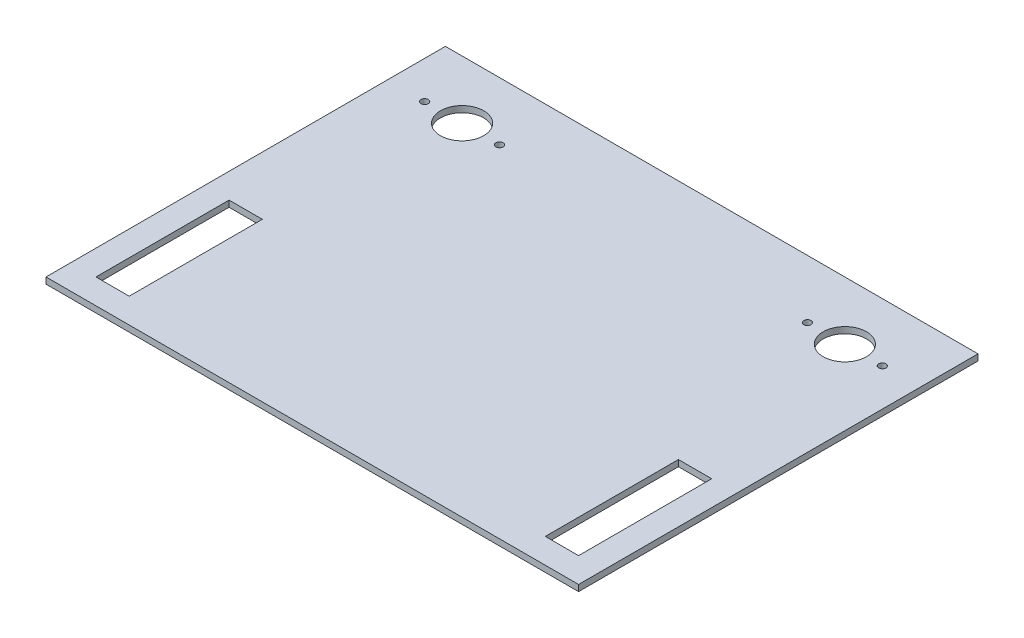
from build123d import *

# Parameters (mm, degrees)
SKETCH1_W           = 406.4
SKETCH1_H           = 304.8
BOSS_EXTRUDE1_DEPTH = 4.7625
SKETCH2_R           = 16.51
SKETCH2_R_2         = 2.778125
SKETCH2_W           = 25.4
SKETCH2_H           = 101.6
CUT_EXTRUDE1_DEPTH  = 6.35


with BuildPart() as part:
    # Sketch1 → Boss-Extrude1 (new body)
    with BuildSketch(Plane(origin=(0, 0, 0), x_dir=(1, 0, 0), z_dir=(0, 1, 0))):
        with Locations((203.2, 152.4)):
            Rectangle(SKETCH1_W, SKETCH1_H)
    extrude(amount=BOSS_EXTRUDE1_DEPTH)

    # Sketch2 → Cut-Extrude1 (cut)
    with BuildSketch(Plane(origin=(0, 4.7625, 0), x_dir=(1, 0, 0), z_dir=(0, 1, 0))):
        with Locations(Location((57.15, 260.35, 0), (0, 0, 270))):
            Circle(SKETCH2_R)
        with Locations(Location((85.725, 260.35, 0), (0, 0, 270))):
            Circle(SKETCH2_R_2)
        with Locations(Location((28.575, 260.35, 0), (0, 0, 270))):
            Circle(SKETCH2_R_2)
        with Locations(Location((377.825, 260.35, 0), (0, 0, 90))):
            Circle(SKETCH2_R_2)
        with Locations(Location((320.675, 260.35, 0), (0, 0, 90))):
            Circle(SKETCH2_R_2)
        with Locations(Location((349.25, 260.35, 0), (0, 0, 90))):
            Circle(SKETCH2_R)
        with Locations((31.75, 69.85)):
            Rectangle(SKETCH2_W, SKETCH2_H)
        with Locations((374.65, 69.85)):
            Rectangle(SKETCH2_W, SKETCH2_H)
    extrude(amount=-CUT_EXTRUDE1_DEPTH, mode=Mode.SUBTRACT)


solid = part.part
